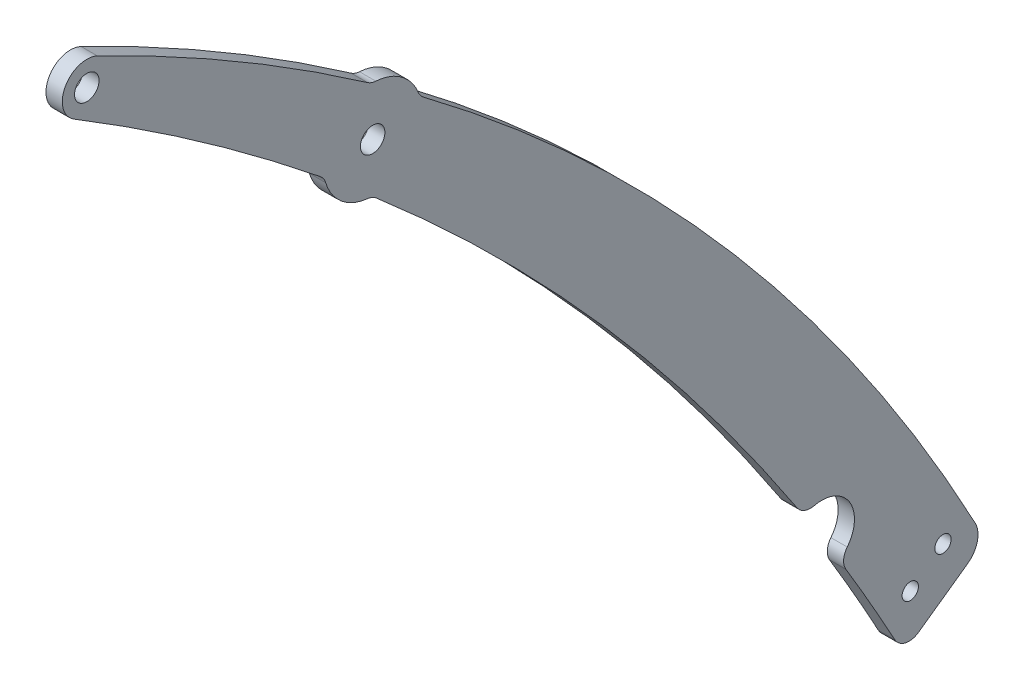
from build123d import *

# Parameters (mm, degrees)
SKETCH_1_R      = 1
SKETCH_1_R_2    = 1.5
EXTRUDE_1_DEPTH = 2


with BuildPart() as part:
    # 草图1 → 凸台-拉伸1 (new body)
    with BuildSketch(Plane(origin=(0, 0, 0), x_dir=(0, 0, -1), z_dir=(1, 0, 0))):
        with BuildLine():
            Line((107.863715966, -104.404074838), (101.845843381, -108.686473232))
            ThreePointArc((101.845843381, -108.686473232), (100.236001316, -109.005608731), (98.929340159, -108.012595355))
            ThreePointArc((98.929340159, -108.012595355), (95.996901234, -102.756809465), (92.952174798, -97.565265927))
            ThreePointArc((92.952174798, -97.565265927), (92.67119221, -96.396525563), (93.110928625, -95.277804356))
            ThreePointArc((93.110928625, -95.277804356), (93.386262354, -90.634283432), (89.082079375, -88.870167754))
            ThreePointArc((89.082079375, -88.870167754), (87.883298953, -88.781676215), (86.951761021, -88.02197737))
            ThreePointArc((86.951761021, -88.02197737), (63.249240179, -56.927091802), (35.446375502, -29.437055089))
            ThreePointArc((35.446375502, -29.437055089), (34.93756912, -29.118601809), (34.357184804, -28.965466337))
            ThreePointArc((34.357184804, -28.965466337), (31.162596189, -27.612410648), (29.250996223, -24.717252331))
            ThreePointArc((29.250996223, -24.717252331), (28.99483955, -24.174407799), (28.589143834, -23.732019493))
            ThreePointArc((28.589143834, -23.732019493), (13.863721442, -12.651321704), (-1.558710581, -2.56328331))
            ThreePointArc((-1.558710581, -2.56328331), (-2.635591887, 1.433058061), (1.304059018, 2.701745746))
            ThreePointArc((1.304059018, 2.701745746), (18.225711529, -6.316411442), (34.373430157, -16.656656404))
            ThreePointArc((34.373430157, -16.656656404), (34.856722013, -16.904193707), (35.388785697, -17.012609443))
            ThreePointArc((35.388785697, -17.012609443), (38.521022393, -18.141769735), (40.568988637, -20.766982858))
            ThreePointArc((40.568988637, -20.766982858), (40.837621253, -21.238875062), (41.223285286, -21.621117118))
            ThreePointArc((41.223285286, -21.621117118), (79.319293236, -57.386189934), (108.771734361, -100.548673263))
            ThreePointArc((108.771734361, -100.548673263), (109.044434758, -102.647527604), (107.863715966, -104.404074838))
        make_face()
        with Locations((100.83272848, -103.814691777)):
            Circle(SKETCH_1_R, mode=Mode.SUBTRACT)
        with Locations((104.83272848, -100.814691777)):
            Circle(SKETCH_1_R, mode=Mode.SUBTRACT)
        with Locations((35, -23)):
            Circle(SKETCH_1_R_2, mode=Mode.SUBTRACT)
        Circle(SKETCH_1_R_2, mode=Mode.SUBTRACT)
    extrude(amount=EXTRUDE_1_DEPTH)


solid = part.part
